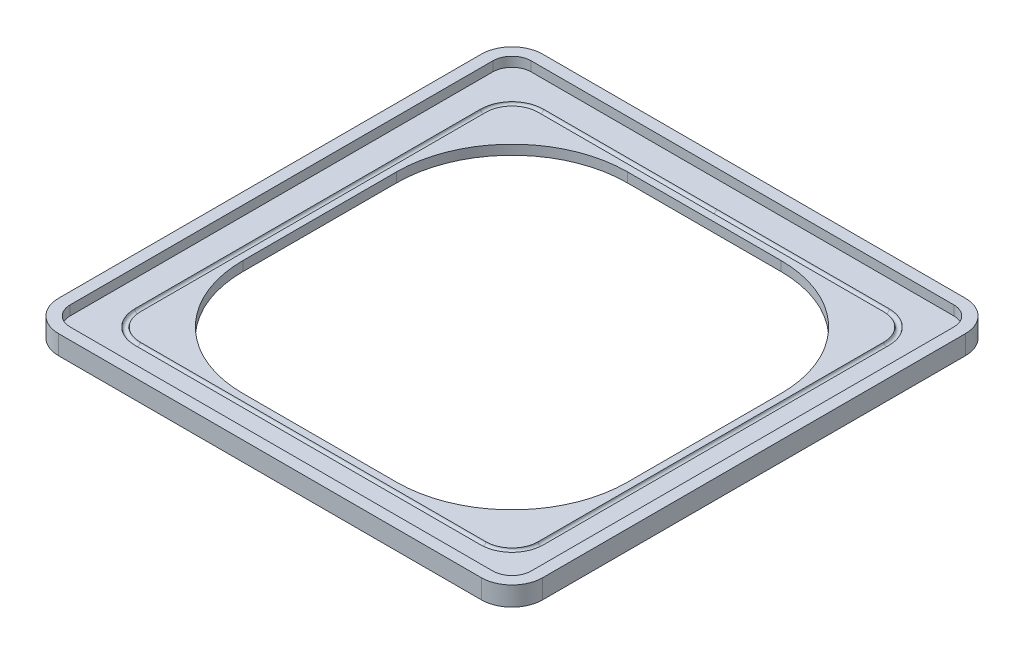
from build123d import *

# Parameters (mm, degrees)
SKETCH1_W           = 304.8
SKETCH1_H           = 304.8
SKETCH1_W_2         = 254
SKETCH1_H_2         = 254
BOSS_EXTRUDE1_DEPTH = 6.35
FILLET1_R           = 76.2
FILLET2_R           = 12.7
SKETCH4_R           = 1.7653
BOSS_EXTRUDE2_DEPTH = 12.7


with BuildPart() as part:
    # Sketch1 → Boss-Extrude1 (new body)
    with BuildSketch(Plane(origin=(0, 0, 0), x_dir=(1, 0, 0), z_dir=(0, 1, 0))):
        Rectangle(SKETCH1_W, SKETCH1_H)
        Rectangle(SKETCH1_W_2, SKETCH1_H_2, mode=Mode.SUBTRACT)
    extrude(amount=BOSS_EXTRUDE1_DEPTH)

    # Fillet1
    fillet1_edges = [part.edges().sort_by_distance(p)[0] for p in [
        (-127, 3.175, -127),
        (-127, 3.175, 127),
        (127, 3.175, 127),
        (127, 3.175, -127),
    ]]
    fillet(fillet1_edges, radius=FILLET1_R)

    # Fillet2
    fillet2_edges = [part.edges().sort_by_distance(p)[0] for p in [
        (152.4, 3.175, 152.4),
        (-152.4, 3.175, 152.4),
        (-152.4, 3.175, -152.4),
        (152.4, 3.175, -152.4),
    ]]
    fillet(fillet2_edges, radius=FILLET2_R)

    # Cut-Sweep1: sweep along a path in Sketch3
    with BuildLine(Plane(origin=(0, 6.35, 0), x_dir=(1, 0, 0), z_dir=(0, 1, 0))) as cut_sweep1_path:
        Line((114.3, -133.35), (-114.3, -133.35))
        ThreePointArc((-114.3, -133.35), (-127.770384182, -127.770384182), (-133.35, -114.3))
        Line((-133.35, -114.3), (-133.35, 114.3))
        ThreePointArc((-133.35, 114.3), (-127.770384182, 127.770384182), (-114.3, 133.35))
        Line((-114.3, 133.35), (114.3, 133.35))
        ThreePointArc((114.3, 133.35), (127.770384182, 127.770384182), (133.35, 114.3))
        Line((133.35, 114.3), (133.35, -114.3))
        ThreePointArc((133.35, -114.3), (127.770384182, -127.770384182), (114.3, -133.35))
    # Sketch4 → Cut-Sweep1 (sweep, cut)
    with BuildSketch(Plane(origin=(0, 0, 0), x_dir=(0, 0, -1), z_dir=(1, 0, 0))):
        with Locations((133.35, 6.35)):
            Circle(SKETCH4_R)
    sweep(path=cut_sweep1_path.line, mode=Mode.SUBTRACT)


with BuildPart() as body_2:
    # Sketch5 → Boss-Extrude2 (new body)
    with BuildSketch(Plane.XZ):
        with BuildLine():
            Line((139.7, 160.02), (-139.7, 160.02))
            ThreePointArc((-139.7, 160.02), (-154.068409794, 154.068409794), (-160.02, 139.7))
            Line((-160.02, 139.7), (-160.02, -139.7))
            ThreePointArc((-160.02, -139.7), (-154.068409794, -154.068409794), (-139.7, -160.02))
            Line((-139.7, -160.02), (139.7, -160.02))
            ThreePointArc((139.7, -160.02), (154.068409794, -154.068409794), (160.02, -139.7))
            Line((160.02, -139.7), (160.02, 139.7))
            ThreePointArc((160.02, 139.7), (154.068409794, 154.068409794), (139.7, 160.02))
        make_face()
        with BuildLine():
            Line((139.7, 152.4), (-139.7, 152.4))
            ThreePointArc((-139.7, 152.4), (-148.680256121, 148.680256121), (-152.4, 139.7))
            Line((-152.4, 139.7), (-152.4, -139.7))
            ThreePointArc((-152.4, -139.7), (-148.680256121, -148.680256121), (-139.7, -152.4))
            Line((-139.7, -152.4), (139.7, -152.4))
            ThreePointArc((139.7, -152.4), (148.680256121, -148.680256121), (152.4, -139.7))
            Line((152.4, -139.7), (152.4, 139.7))
            ThreePointArc((152.4, 139.7), (148.680256121, 148.680256121), (139.7, 152.4))
        make_face(mode=Mode.SUBTRACT)
    extrude(amount=-BOSS_EXTRUDE2_DEPTH)


solid = Compound([part.part, body_2.part])
